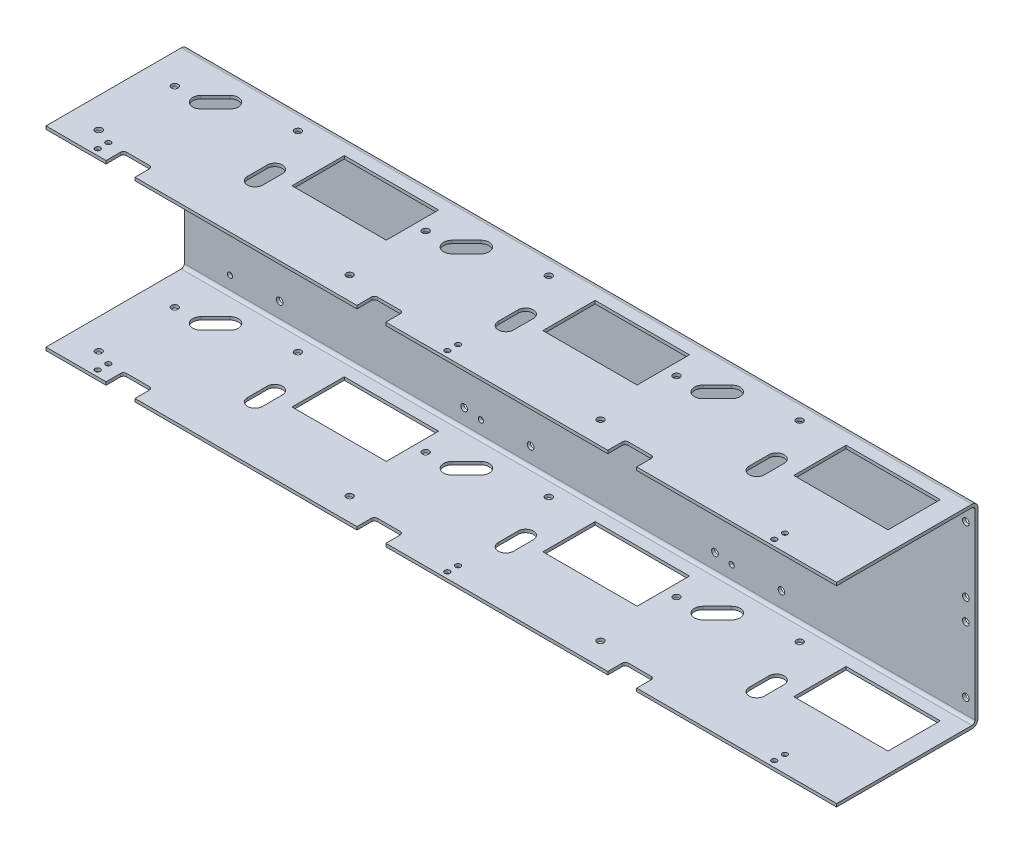
from build123d import *

# Parameters (mm, degrees)
CHASSIS_SECTION_DEPTH           = 520
FLOOR_MOUNTING_HOLES_SKETCH_R   = 1.7
FLOOR_MOUNTING_HOLES_SKETCH_R_2 = 2.2
FLOOR_MOUNTING_HOLES_DEPTH      = 2.4
WALL_OPENINGS_SKETCH_R          = 2.2
WALL_OPENINGS_SKETCH_R_2        = 1.7
WALL_OPENINGS_SKETCH_W          = 62
WALL_OPENINGS_SKETCH_H          = 34.4
WALL_OPENINGS_DEPTH             = 130


with BuildPart() as part:
    # Chassis Section Sketch → Chassis Section (new body)
    with BuildSketch(Plane(origin=(-285, 0, 0), x_dir=(0, 0, -1), z_dir=(1, 0, 0))):
        with BuildLine():
            Line((-40, -64), (49, -64))
            ThreePointArc((49, -64), (51.828427125, -62.828427125), (53, -60))
            Line((53, -60), (53, 60))
            ThreePointArc((53, 60), (51.828427125, 62.828427125), (49, 64))
            Line((49, 64), (-40, 64))
            Line((-40, 64), (-40, 62))
            Line((-40, 62), (49, 62))
            ThreePointArc((49, 62), (50.414213562, 61.414213562), (51, 60))
            Line((51, 60), (51, -60))
            ThreePointArc((51, -60), (50.414213562, -61.414213562), (49, -62))
            Line((49, -62), (-40, -62))
            Line((-40, -62), (-40, -64))
        make_face()
    extrude(amount=CHASSIS_SECTION_DEPTH)

    # Floor Mounting Holes Sketch → Floor Mounting Holes (cut)
    with BuildSketch(Plane.XY.offset(-53.2)):
        with Locations(Location((-255, -51.5, 0), (0, 0, 180))):
            Circle(FLOOR_MOUNTING_HOLES_SKETCH_R)
        with Locations(Location((-222.291651246, -50, 0), (0, 0, 180))):
            Circle(FLOOR_MOUNTING_HOLES_SKETCH_R_2)
        with Locations(Location((-101, -50, 0), (0, 0, 180))):
            Circle(FLOOR_MOUNTING_HOLES_SKETCH_R_2)
        with Locations(Location((-90, -51.5, 0), (0, 0, 180))):
            Circle(FLOOR_MOUNTING_HOLES_SKETCH_R)
        with Locations(Location((-57.291651246, -50, 0), (0, 0, 180))):
            Circle(FLOOR_MOUNTING_HOLES_SKETCH_R_2)
        with Locations(Location((-222.291651246, -7, 0), (0, 0, 180))):
            Circle(FLOOR_MOUNTING_HOLES_SKETCH_R_2)
        with Locations(Location((-101, -7, 0), (0, 0, 180))):
            Circle(FLOOR_MOUNTING_HOLES_SKETCH_R_2)
        with Locations(Location((-57.291651246, -7, 0), (0, 0, 180))):
            Circle(FLOOR_MOUNTING_HOLES_SKETCH_R_2)
        with Locations(Location((64, -50, 0), (0, 0, 180))):
            Circle(FLOOR_MOUNTING_HOLES_SKETCH_R_2)
        with Locations(Location((75, -51.5, 0), (0, 0, 180))):
            Circle(FLOOR_MOUNTING_HOLES_SKETCH_R)
        with Locations(Location((107.708348754, -50, 0), (0, 0, 180))):
            Circle(FLOOR_MOUNTING_HOLES_SKETCH_R_2)
        with Locations(Location((229, -50, 0), (0, 0, 180))):
            Circle(FLOOR_MOUNTING_HOLES_SKETCH_R_2)
        with Locations(Location((64, -7, 0), (0, 0, 180))):
            Circle(FLOOR_MOUNTING_HOLES_SKETCH_R_2)
        with Locations(Location((107.708348754, -7, 0), (0, 0, 180))):
            Circle(FLOOR_MOUNTING_HOLES_SKETCH_R_2)
        with Locations(Location((229, -7, 0), (0, 0, 180))):
            Circle(FLOOR_MOUNTING_HOLES_SKETCH_R_2)
        with Locations(Location((-222.291651246, 7, 0), (0, 0, 180))):
            Circle(FLOOR_MOUNTING_HOLES_SKETCH_R_2)
        with Locations(Location((-101, 7, 0), (0, 0, 180))):
            Circle(FLOOR_MOUNTING_HOLES_SKETCH_R_2)
        with Locations(Location((-57.291651246, 7, 0), (0, 0, 180))):
            Circle(FLOOR_MOUNTING_HOLES_SKETCH_R_2)
        with Locations(Location((-255, 51.5, 0), (0, 0, 180))):
            Circle(FLOOR_MOUNTING_HOLES_SKETCH_R)
        with Locations(Location((-222.291651246, 50, 0), (0, 0, 180))):
            Circle(FLOOR_MOUNTING_HOLES_SKETCH_R_2)
        with Locations(Location((-101, 50, 0), (0, 0, 180))):
            Circle(FLOOR_MOUNTING_HOLES_SKETCH_R_2)
        with Locations(Location((-90, 51.5, 0), (0, 0, 180))):
            Circle(FLOOR_MOUNTING_HOLES_SKETCH_R)
        with Locations(Location((-57.291651246, 50, 0), (0, 0, 180))):
            Circle(FLOOR_MOUNTING_HOLES_SKETCH_R_2)
        with Locations(Location((64, 7, 0), (0, 0, 180))):
            Circle(FLOOR_MOUNTING_HOLES_SKETCH_R_2)
        with Locations(Location((107.708348754, 7, 0), (0, 0, 180))):
            Circle(FLOOR_MOUNTING_HOLES_SKETCH_R_2)
        with Locations(Location((229, 7, 0), (0, 0, 180))):
            Circle(FLOOR_MOUNTING_HOLES_SKETCH_R_2)
        with Locations(Location((64, 50, 0), (0, 0, 180))):
            Circle(FLOOR_MOUNTING_HOLES_SKETCH_R_2)
        with Locations(Location((75, 51.5, 0), (0, 0, 180))):
            Circle(FLOOR_MOUNTING_HOLES_SKETCH_R)
        with Locations(Location((107.708348754, 50, 0), (0, 0, 180))):
            Circle(FLOOR_MOUNTING_HOLES_SKETCH_R_2)
        with Locations(Location((229, 50, 0), (0, 0, 180))):
            Circle(FLOOR_MOUNTING_HOLES_SKETCH_R_2)
    extrude(amount=FLOOR_MOUNTING_HOLES_DEPTH, mode=Mode.SUBTRACT)

    # Wall Openings Sketch → Wall Openings (cut)
    with BuildSketch(Plane(origin=(0, -65, 0), x_dir=(-1, 0, 0), z_dir=(0, -1, 0))):
        with Locations(Location((265.291651246, 25, 0), (0, 0, 90))):
            Circle(WALL_OPENINGS_SKETCH_R)
        with Locations(Location((199.291651246, 40, 0), (0, 0, 90))):
            Circle(WALL_OPENINGS_SKETCH_R)
        with Locations(Location((100.291651246, 25, 0), (0, 0, 90))):
            Circle(WALL_OPENINGS_SKETCH_R)
        with Locations(Location((34.291651246, 40, 0), (0, 0, 90))):
            Circle(WALL_OPENINGS_SKETCH_R)
        with Locations(Location((265.291651246, -25, 0), (0, 0, 90))):
            Circle(WALL_OPENINGS_SKETCH_R)
        with Locations(Location((255, -29, 0), (0, 0, 90))):
            Circle(WALL_OPENINGS_SKETCH_R_2)
        with Locations(Location((255, -36, 0), (0, 0, 90))):
            Circle(WALL_OPENINGS_SKETCH_R_2)
        with Locations(Location((100.291651246, -25, 0), (0, 0, 90))):
            Circle(WALL_OPENINGS_SKETCH_R)
        with Locations(Location((25, -29, 0), (0, 0, 90))):
            Circle(WALL_OPENINGS_SKETCH_R_2)
        with Locations(Location((25, -36, 0), (0, 0, 90))):
            Circle(WALL_OPENINGS_SKETCH_R_2)
        with Locations(Location((-64.708348754, 25, 0), (0, 0, 90))):
            Circle(WALL_OPENINGS_SKETCH_R)
        with Locations(Location((-130.708348754, 40, 0), (0, 0, 90))):
            Circle(WALL_OPENINGS_SKETCH_R)
        with Locations(Location((-64.708348754, -25, 0), (0, 0, 90))):
            Circle(WALL_OPENINGS_SKETCH_R)
        with Locations(Location((-190, -29, 0), (0, 0, 90))):
            Circle(WALL_OPENINGS_SKETCH_R_2)
        with Locations(Location((-190, -36, 0), (0, 0, 90))):
            Circle(WALL_OPENINGS_SKETCH_R_2)
        with Locations((139, 24)):
            Rectangle(WALL_OPENINGS_SKETCH_W, WALL_OPENINGS_SKETCH_H)
        with BuildLine():
            Line((180, 10.5), (180, -2.5))
            ThreePointArc((180, -2.5), (185, -7.5), (190, -2.5))
            Line((190, -2.5), (190, 10.5))
            ThreePointArc((190, 10.5), (185, 15.5), (180, 10.5))
        make_face()
        with BuildLine():
            Line((243.5, -28.5), (228.5, -28.5))
            ThreePointArc((228.5, -28.5), (227.085786438, -29.085786438), (226.5, -30.5))
            Line((226.5, -30.5), (226.5, -40))
            ThreePointArc((226.5, -40), (227.085786438, -41.414213562), (228.5, -42))
            Line((228.5, -42), (243.5, -42))
            ThreePointArc((243.5, -42), (244.914213562, -41.414213562), (245.5, -40))
            Line((245.5, -40), (245.5, -30.5))
            ThreePointArc((245.5, -30.5), (244.914213562, -29.085786438), (243.5, -28.5))
        make_face()
        with BuildLine():
            Line((251.389087297, 28.389087297), (241.889087297, 37.889087297))
            ThreePointArc((241.889087297, 37.889087297), (234.110912703, 37.889087297), (234.110912703, 30.110912703))
            Line((234.110912703, 30.110912703), (243.610912703, 20.610912703))
            ThreePointArc((243.610912703, 20.610912703), (251.389087297, 20.610912703), (251.389087297, 28.389087297))
        make_face()
        with Locations((-26, 24)):
            Rectangle(WALL_OPENINGS_SKETCH_W, WALL_OPENINGS_SKETCH_H)
        with BuildLine():
            Line((15, 10.5), (15, -2.5))
            ThreePointArc((15, -2.5), (20, -7.5), (25, -2.5))
            Line((25, -2.5), (25, 10.5))
            ThreePointArc((25, 10.5), (20, 15.5), (15, 10.5))
        make_face()
        with BuildLine():
            Line((78.5, -28.5), (63.5, -28.5))
            ThreePointArc((63.5, -28.5), (62.085786438, -29.085786438), (61.5, -30.5))
            Line((61.5, -30.5), (61.5, -40))
            ThreePointArc((61.5, -40), (62.085786438, -41.414213562), (63.5, -42))
            Line((63.5, -42), (78.5, -42))
            ThreePointArc((78.5, -42), (79.914213562, -41.414213562), (80.5, -40))
            Line((80.5, -40), (80.5, -30.5))
            ThreePointArc((80.5, -30.5), (79.914213562, -29.085786438), (78.5, -28.5))
        make_face()
        with BuildLine():
            Line((86.389087297, 28.389087297), (76.889087297, 37.889087297))
            ThreePointArc((76.889087297, 37.889087297), (69.110912703, 37.889087297), (69.110912703, 30.110912703))
            Line((69.110912703, 30.110912703), (78.610912703, 20.610912703))
            ThreePointArc((78.610912703, 20.610912703), (86.389087297, 20.610912703), (86.389087297, 28.389087297))
        make_face()
        with Locations((-191, 24)):
            Rectangle(WALL_OPENINGS_SKETCH_W, WALL_OPENINGS_SKETCH_H)
        with BuildLine():
            Line((-150, 10.5), (-150, -2.5))
            ThreePointArc((-150, -2.5), (-145, -7.5), (-140, -2.5))
            Line((-140, -2.5), (-140, 10.5))
            ThreePointArc((-140, 10.5), (-145, 15.5), (-150, 10.5))
        make_face()
        with BuildLine():
            Line((-86.5, -28.5), (-101.5, -28.5))
            ThreePointArc((-101.5, -28.5), (-102.914213562, -29.085786438), (-103.5, -30.5))
            Line((-103.5, -30.5), (-103.5, -40))
            ThreePointArc((-103.5, -40), (-102.914213562, -41.414213562), (-101.5, -42))
            Line((-101.5, -42), (-86.5, -42))
            ThreePointArc((-86.5, -42), (-85.085786438, -41.414213562), (-84.5, -40))
            Line((-84.5, -40), (-84.5, -30.5))
            ThreePointArc((-84.5, -30.5), (-85.085786438, -29.085786438), (-86.5, -28.5))
        make_face()
        with BuildLine():
            Line((-78.610912703, 28.389087297), (-88.110912703, 37.889087297))
            ThreePointArc((-88.110912703, 37.889087297), (-95.889087297, 37.889087297), (-95.889087297, 30.110912703))
            Line((-95.889087297, 30.110912703), (-86.389087297, 20.610912703))
            ThreePointArc((-86.389087297, 20.610912703), (-78.610912703, 20.610912703), (-78.610912703, 28.389087297))
        make_face()
    extrude(amount=-WALL_OPENINGS_DEPTH, mode=Mode.SUBTRACT)


solid = part.part
